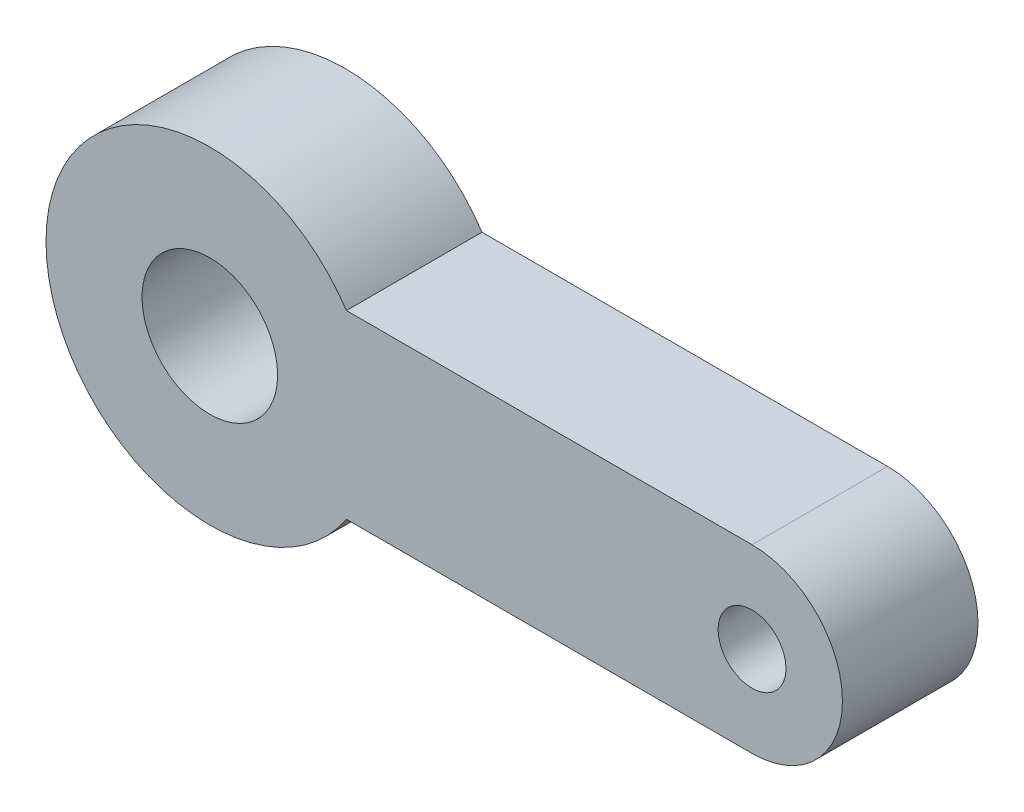
from build123d import *

# Parameters (mm, degrees)
SKETCH_1_R          = 7.25
SKETCH_1_R_2        = 4
EXTRUDE_1_DEPTH     = 6
SKETCH_2_R          = 3
SKETCH_2_R_2        = 1.5
CUT_EXTRUDE_1_DEPTH = 6


with BuildPart() as part:
    # 草图1 → 凸台-拉伸1 (new body)
    with BuildSketch(Plane.XY):
        with Locations((-10.375, 0)):
            Circle(SKETCH_1_R)
        with BuildLine():
            ThreePointArc((13.625, -4), (9.625, 0), (13.625, 4))
            Line((13.625, 4), (-4.328306689, 4))
            ThreePointArc((-4.328306689, 4), (-3.432341053, 2.088536987), (-3.125, 0))
            ThreePointArc((-3.125, 0), (-3.432341053, -2.088536987), (-4.328306689, -4))
            Line((-4.328306689, -4), (13.625, -4))
        make_face()
        with Locations((13.625, 0)):
            Circle(SKETCH_1_R_2)
    extrude(amount=EXTRUDE_1_DEPTH)

    # 草图2 → 切除-拉伸1 (cut)
    with BuildSketch(Plane.XY.offset(6)):
        with Locations((-10.375, 0)):
            Circle(SKETCH_2_R)
        with Locations((13.625, 0)):
            Circle(SKETCH_2_R_2)
    extrude(amount=-CUT_EXTRUDE_1_DEPTH, mode=Mode.SUBTRACT)


solid = part.part
